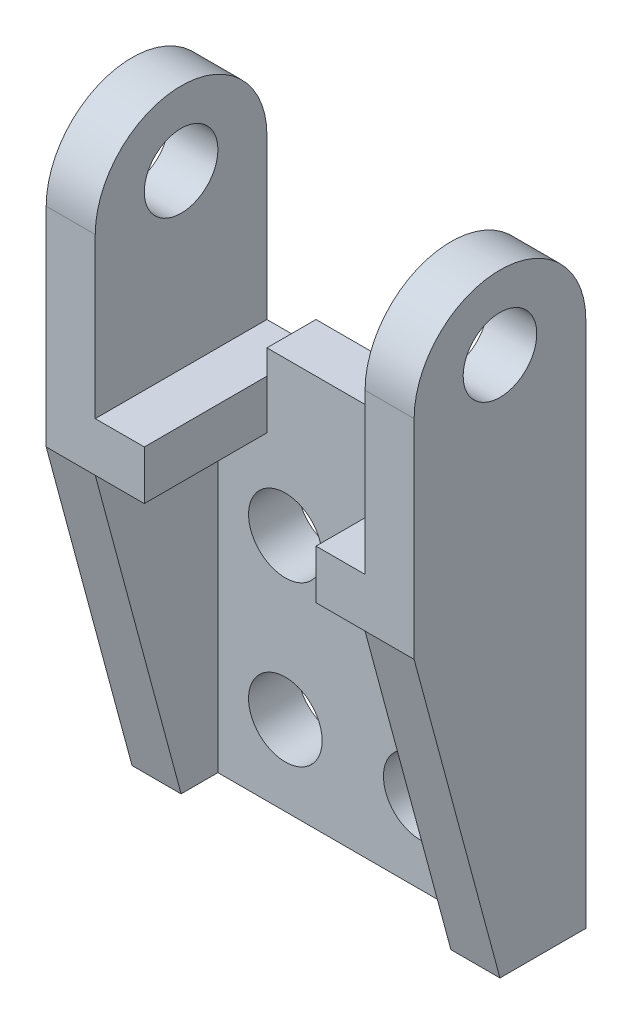
from build123d import *

# Parameters (mm, degrees)
SKETCH_1_W          = 15
SKETCH_1_H          = 25
EXTRUDE_1_DEPTH     = 7
CUT_EXTRUDE_1_DEPTH = 5
SKETCH_3_W          = 2
SKETCH_3_H          = 10
CUT_EXTRUDE_2_DEPTH = 13
SKETCH_4_W          = 2
SKETCH_4_H          = 3
CUT_EXTRUDE_3_DEPTH = 20.345542122
SKETCH_5_W          = 7
SKETCH_5_H          = 6
CUT_EXTRUDE_4_DEPTH = 13
SKETCH_6_R          = 1.5
EXTRUDE_2_DEPTH     = 2
EXTRUDE_START       = 2
SKETCH_7_R          = 1.5
EXTRUDE_3_DEPTH     = 2
CUT_EXTRUDE_5_DEPTH = 21.742468513
SKETCH_9_R          = 1.5
CUT_EXTRUDE_6_DEPTH = 16.411035007
SKETCH_10_W         = 4
SKETCH_10_H         = 10
EXTRUDE_5_DEPTH     = 7
SKETCH_12_W         = 2
SKETCH_12_H         = 10
CUT_EXTRUDE_7_DEPTH = 17.170961629
SKETCH_14_R         = 1.5
CUT_EXTRUDE_9_DEPTH = 21.742468513
FILLET_1_RADIUS     = 3.5
FILLET_1_LENGTH     = 2
FILLET_2_RADIUS     = 3.5
FILLET_2_LENGTH     = 2


with BuildPart() as part:
    # Эскиз1 → Бобышка-Вытянуть1 (new body)
    with BuildSketch(Plane.XY):
        Rectangle(SKETCH_1_W, SKETCH_1_H)
    extrude(amount=EXTRUDE_1_DEPTH)

    # Эскиз2 → Вырез-Вытянуть1 (cut)
    with BuildSketch(Plane.XY.offset(7)):
        Polygon((-3.5, 0.5), (-5.5, 0.5), (-5.5, -12.5), (5.5, -12.5), (5.5, 0.5), (3.5, 0.5), (3.5, 12.5), (-3.5, 12.5), align=None)
    extrude(amount=-CUT_EXTRUDE_1_DEPTH, mode=Mode.SUBTRACT)

    # Эскиз3 → Вырез-Вытянуть2 (cut)
    with BuildSketch(Plane.XY.offset(7)):
        with Locations((-6.5, 7.5)):
            Rectangle(SKETCH_3_W, SKETCH_3_H)
        with Locations((6.5, 7.5)):
            Rectangle(SKETCH_3_W, SKETCH_3_H)
    extrude(amount=-CUT_EXTRUDE_2_DEPTH, mode=Mode.SUBTRACT)

    # Эскиз4 → Вырез-Вытянуть3 (cut, through all)
    with BuildSketch(Plane.ZY.offset(5.5)):
        with Locations((6, 11)):
            Rectangle(SKETCH_4_W, SKETCH_4_H)
        with Locations((1, 11)):
            Rectangle(SKETCH_4_W, SKETCH_4_H)
    extrude(amount=-CUT_EXTRUDE_3_DEPTH, mode=Mode.SUBTRACT)

    # Эскиз5 → Вырез-Вытянуть4 (cut)
    with BuildSketch(Plane.XY.offset(2)):
        with Locations((0, 6.5)):
            Rectangle(SKETCH_5_W, SKETCH_5_H)
    extrude(amount=-CUT_EXTRUDE_4_DEPTH, mode=Mode.SUBTRACT)

    # Эскиз6 → Бобышка-Вытянуть2 (add)
    with BuildSketch(Plane.ZY.offset(5.5)):
        with Locations(Location((3.5, 9.5, 0), (0, 0, 180))):
            Circle(SKETCH_6_R)
    extrude(amount=EXTRUDE_2_DEPTH)

    # Эскиз7 → Бобышка-Вытянуть3 (add)
    with BuildSketch(Plane(origin=(5.5, 0, 0), x_dir=(0, 0, -1), z_dir=(1, 0, 0)).offset(EXTRUDE_START)):
        with Locations((-3.5, 9.5)):
            Circle(SKETCH_7_R)
    extrude(amount=-EXTRUDE_3_DEPTH)

    # Эскиз8 → Вырез-Вытянуть5 (cut, through all)
    with BuildSketch(Plane.ZY.offset(7.5)):
        Polygon((7, 0.5), (3.5, -12.5), (7, -12.5), align=None)
    extrude(amount=-CUT_EXTRUDE_5_DEPTH, mode=Mode.SUBTRACT)

    # Эскиз9 → Вырез-Вытянуть6 (cut, through all)
    with BuildSketch(Plane.XY.offset(2)):
        with Locations((-2.75, -2.75)):
            Circle(SKETCH_9_R)
        with Locations((2.75, -2.75)):
            Circle(SKETCH_9_R)
        with Locations((-2.75, -9.25)):
            Circle(SKETCH_9_R)
        with Locations((2.75, -9.25)):
            Circle(SKETCH_9_R)
    extrude(amount=-CUT_EXTRUDE_6_DEPTH, mode=Mode.SUBTRACT)

    # Эскиз10 → Бобышка-Вытянуть5 (add)
    with BuildSketch(Plane.XY.offset(7)):
        with Locations((-5.5, 7.5)):
            Rectangle(SKETCH_10_W, SKETCH_10_H)
        with Locations((5.5, 7.5)):
            Rectangle(SKETCH_10_W, SKETCH_10_H)
    extrude(amount=-EXTRUDE_5_DEPTH)

    # Эскиз12 → Вырез-Вытянуть7 (cut, through all)
    with BuildSketch(Plane.XY.offset(7)):
        with Locations((4.5, 7.5)):
            Rectangle(SKETCH_12_W, SKETCH_12_H)
        with Locations((-4.5, 7.5)):
            Rectangle(SKETCH_12_W, SKETCH_12_H)
    extrude(amount=-CUT_EXTRUDE_7_DEPTH, mode=Mode.SUBTRACT)

    # Эскиз14 → Вырез-Вытянуть9 (cut, through all)
    with BuildSketch(Plane.ZY.offset(7.5)):
        with Locations(Location((3.5, 9.5, 0), (0, 0, 270))):
            Circle(SKETCH_14_R)
    extrude(amount=-CUT_EXTRUDE_9_DEPTH, mode=Mode.SUBTRACT)

    # Скругление1: full round fillet: the end face becomes a half cylinder, R = half its width
    fillet_1_face = Plane((-6.5, 12.5, 3.5), x_dir=(1, 0, 0), z_dir=(0, 1, 0))  # on the end face: x along it, z out of the body
    fillet_1_slab = fillet_1_face.offset(-FILLET_1_RADIUS / 2) * Box(FILLET_1_LENGTH, 2 * FILLET_1_RADIUS, FILLET_1_RADIUS, mode=Mode.PRIVATE)  # the body's end, R deep
    fillet_1_round = Plane((-6.5, 9, 3.5), x_dir=(0, 1, 0), z_dir=(1, 0, 0)) * Cylinder(FILLET_1_RADIUS, FILLET_1_LENGTH, mode=Mode.PRIVATE)  # its axis R under the face
    add(fillet_1_slab - fillet_1_round, mode=Mode.SUBTRACT)

    # Скругление2: full round fillet: the end face becomes a half cylinder, R = half its width
    fillet_2_face = Plane((6.5, 12.5, 3.5), x_dir=(1, 0, 0), z_dir=(0, 1, 0))  # on the end face: x along it, z out of the body
    fillet_2_slab = fillet_2_face.offset(-FILLET_2_RADIUS / 2) * Box(FILLET_2_LENGTH, 2 * FILLET_2_RADIUS, FILLET_2_RADIUS, mode=Mode.PRIVATE)  # the body's end, R deep
    fillet_2_round = Plane((6.5, 9, 3.5), x_dir=(0, 1, 0), z_dir=(1, 0, 0)) * Cylinder(FILLET_2_RADIUS, FILLET_2_LENGTH, mode=Mode.PRIVATE)  # its axis R under the face
    add(fillet_2_slab - fillet_2_round, mode=Mode.SUBTRACT)


solid = part.part
